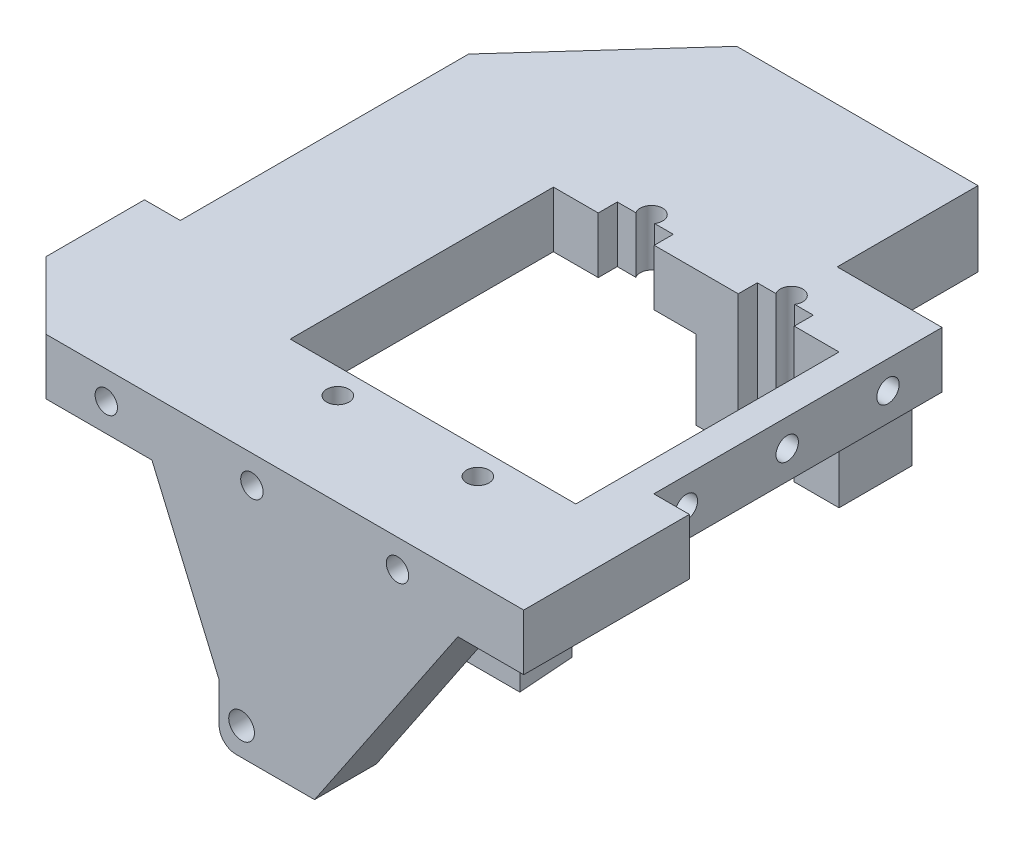
from build123d import *

# Parameters (mm, degrees)
EXTRUDE_1_DEPTH     = 5
SKETCH_4_R          = 0.999999968
SKETCH_4_R_2        = 1.000000188
CUT_EXTRUDE_1_DEPTH = 5
SKETCH_6_R          = 1.000000276
SKETCH_6_R_2        = 0.999999818
CUT_EXTRUDE_2_DEPTH = 5
SKETCH_13_R         = 1.000000021
SKETCH_13_R_2       = 0.999999728
SKETCH_13_R_3       = 0.999999832
CUT_EXTRUDE_3_DEPTH = 6
SKETCH_18_R         = 1.000000534
SKETCH_18_R_2       = 1.000000046
SKETCH_18_R_3       = 0.999998785
CUT_EXTRUDE_5_DEPTH = 3.5
SKETCH_23_R         = 0.999998521
SKETCH_23_R_2       = 0.99999884
SKETCH_23_R_3       = 0.999998599
CUT_EXTRUDE_7_DEPTH = 12
EXTRUDE_5_DEPTH     = 7.05
SKETCH_26_R         = 1.000000188
EXTRUDE_5_2_DEPTH   = 7.05
SKETCH_27_W         = 21.53717804
SKETCH_27_H         = 12.569114685
EXTRUDE_6_DEPTH     = 1.68
SKETCH_28_R         = 1
CUT_EXTRUDE_8_DEPTH = 8
SKETCH_29_R         = 1.149999964
EXTRUDE_7_DEPTH     = 5.530267715


with BuildPart() as part:
    # 草图2 → 凸台-拉伸1 (new body)
    with BuildSketch(Plane(origin=(0, 0, 0), x_dir=(1, 0, 0), z_dir=(0, 1, 0))):
        Polygon((-16.950000763, 14.201086044), (25.699960709, 14.201086044), (25.699960709, 28.992816925), (22.523960114, 28.992816925), (22.523960114, 54.730998993), (13.161137581, 54.730880737), (13.161137581, 67.299995422), (-8.376040459, 67.299995422), (-19.75, 54.730998993), (-19.75, 28.992816925), (-22.950000763, 28.992816925), (-22.950000763, 20.201086044), align=None)
    extrude(amount=EXTRUDE_1_DEPTH)

    # 草图4 → 切除-拉伸1 (cut)
    with BuildSketch(Plane.XZ):
        with Locations(Location((0.823959914, -22.48135431, 0), (0, 0, 270))):
            Circle(SKETCH_4_R)
        with Locations(Location((13.323959603, -22.481354784, 0), (0, 0, 270))):
            Circle(SKETCH_4_R_2)
        Polygon((-5.676040173, -24.73135376), (19.823959351, -24.73135376), (19.823959351, -48.23135376), (15.823960304, -48.23135376), (15.823960304, -49.931354523), (10.823960304, -49.931354523), (10.823960304, -48.23135376), (3.323960066, -48.23135376), (3.323960066, -49.931354523), (-1.676040053, -49.931354523), (-1.676040053, -48.23135376), (-5.676040173, -48.23135376), align=None)
    extrude(amount=-CUT_EXTRUDE_1_DEPTH, mode=Mode.SUBTRACT)

    # 草图6 → 切除-拉伸2 (cut)
    with BuildSketch(Plane.XZ):
        with Locations((0.823959833, -50.481354106)):
            Circle(SKETCH_6_R)
        with Locations((13.323959879, -50.481354301)):
            Circle(SKETCH_6_R_2)
    extrude(amount=-CUT_EXTRUDE_2_DEPTH, mode=Mode.SUBTRACT)

    # 草图13 → 切除-拉伸3 (cut)
    with BuildSketch(Plane.XY.offset(-14.201086044)):
        with Locations((1.43202298, 2.499998854)):
            Circle(SKETCH_13_R)
        with Locations((14.432022776, 2.500426737)):
            Circle(SKETCH_13_R_2)
        with Locations((-11.56797721, 2.500425343)):
            Circle(SKETCH_13_R_3)
    extrude(amount=-CUT_EXTRUDE_3_DEPTH, mode=Mode.SUBTRACT)

    # 草图18 → 切除-拉伸5 (cut)
    with BuildSketch(Plane(origin=(22.523960114, 0, 0), x_dir=(0, 0, -1), z_dir=(1, 0, 0))):
        with Locations((31.901501235, 2.515246467)):
            Circle(SKETCH_18_R)
        with Locations((40.901397751, 2.558118146)):
            Circle(SKETCH_18_R_2)
        with Locations((49.901297308, 2.515242677)):
            Circle(SKETCH_18_R_3)
    extrude(amount=-CUT_EXTRUDE_5_DEPTH, mode=Mode.SUBTRACT)

    # 草图23 → 切除-拉伸7 (cut)
    with BuildSketch(Plane.ZY.offset(19.75)):
        with Locations((-31.900998993, 2.5)):
            Circle(SKETCH_23_R)
        with Locations((-40.900998993, 2.5)):
            Circle(SKETCH_23_R_2)
        with Locations((-49.900998993, 2.5)):
            Circle(SKETCH_23_R_3)
    extrude(amount=-CUT_EXTRUDE_7_DEPTH, mode=Mode.SUBTRACT)



with BuildPart() as body_2:
    # 草图26 → 凸台-拉伸5 (new body)
    with BuildSketch(Plane.XZ):
        with BuildLine():
            Line((7.073960185, -48.23135376), (7.073960185, -54.730880737))
            Line((7.073960185, -54.730880737), (19.823959351, -54.730964891))
            Line((19.823959351, -54.730964891), (19.823959351, -48.23135376))
            Line((19.823959351, -48.23135376), (15.823960304, -48.23135376))
            Line((15.823960304, -48.23135376), (15.823960304, -49.931354523))
            Line((15.823960304, -49.931354523), (14.159124462, -49.931354523))
            ThreePointArc((14.159124462, -49.931354523), (13.323959879, -51.481354119), (12.488795296, -49.931354523))
            Line((12.488795296, -49.931354523), (10.823960304, -49.931354523))
            Line((10.823960304, -49.931354523), (10.823960304, -48.23135376))
            Line((10.823960304, -48.23135376), (7.073960185, -48.23135376))
        make_face()
    extrude(amount=EXTRUDE_5_DEPTH)


with BuildPart() as body_3:
    # 草图26 → Extrude 5 2 (new body)
    with BuildSketch(Plane.XZ):
        Polygon((6.658313635, -24.73135376), (6.658313635, -19.73135376), (19.823959351, -19.73135376), (19.466256946, -24.73135376), align=None)
        with Locations(Location((13.323959603, -22.481354784, 0), (0, 0, 270))):
            Circle(SKETCH_26_R, mode=Mode.SUBTRACT)
    extrude(amount=EXTRUDE_5_2_DEPTH)


with BuildPart() as part_1:
    add(part.part)

    add(body_2.part)  # 凸台-拉伸6 merges body 2
    # 草图27 → 凸台-拉伸6 (add)
    with BuildSketch(Plane.XZ):
        with Locations((2.392548561, -61.01543808)):
            Rectangle(SKETCH_27_W, SKETCH_27_H)
    extrude(amount=EXTRUDE_6_DEPTH)

    # 草图28 → 切除-拉伸8 (cut)
    with BuildSketch(Plane(origin=(0, 0, -67.299995422), x_dir=(-1, 0, 0), z_dir=(0, 0, -1))):
        with Locations((-8.161137581, 1.66)):
            Circle(SKETCH_28_R)
        with Locations((2.838862419, 1.66)):
            Circle(SKETCH_28_R)
    extrude(amount=-CUT_EXTRUDE_8_DEPTH, mode=Mode.SUBTRACT)


    add(body_3.part)  # 凸台-拉伸7 merges body 3
    # 草图29 → 凸台-拉伸7 (add)
    with BuildSketch(Plane.XY.offset(-19.73135376)):
        with BuildLine():
            Line((-7.494005203, 0), (19.823959351, 0))
            Line((19.823959351, 0), (7.023960114, -18.999999285))
            Line((7.023960114, -18.999999285), (0.005995274, -18.999999285))
            ThreePointArc((0.005995274, -18.999999285), (-1.054664898, -18.560659457), (-1.494004726, -17.499999285))
            Line((-1.494004726, -17.499999285), (-1.494004726, -13.999999523))
            Line((-1.494004726, -13.999999523), (-7.494005203, 0))
        make_face()
        with Locations(Location((0.512218449, -16.535050796, 0), (0, 0, 180))):
            Circle(SKETCH_29_R, mode=Mode.SUBTRACT)
    extrude(amount=EXTRUDE_7_DEPTH)


solid = part_1.part
